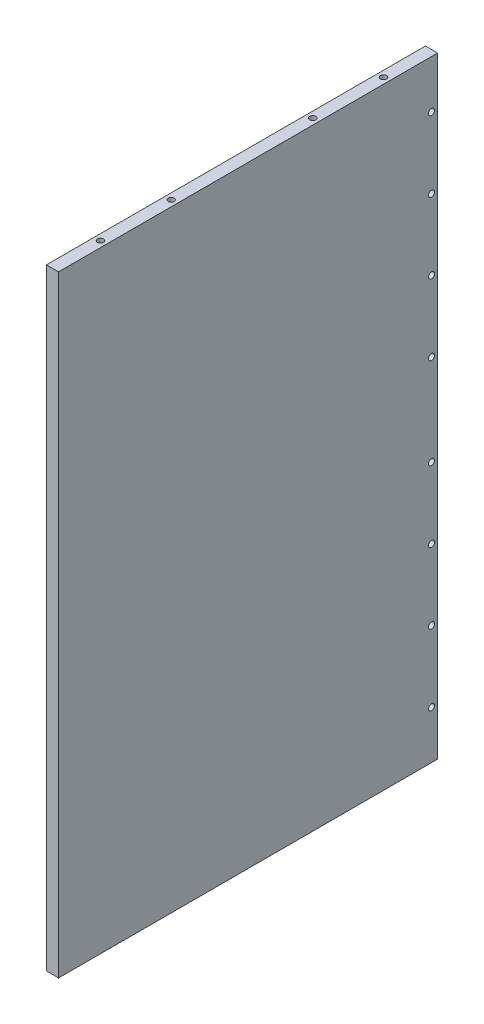
from build123d import *

# Parameters (mm, degrees)
CROQUIS2_W              = 375
CROQUIS2_H              = 605
SALIENTE_EXTRUIR1_DEPTH = 6
CROQUIS3_R              = 3
CORTAR_EXTRUIR1_DEPTH   = 12
CROQUIS6_R              = 3
CORTAR_EXTRUIR2_DEPTH   = 5


with BuildPart() as part:
    # Croquis2 → Saliente-Extruir1 (new, symmetric)
    with BuildSketch(Plane(origin=(0, 0, 0), x_dir=(0, 0, -1), z_dir=(1, 0, 0))):
        Rectangle(CROQUIS2_W, CROQUIS2_H)
    extrude(amount=SALIENTE_EXTRUIR1_DEPTH, both=True)

    # Croquis3 → Cortar-Extruir1 (cut)
    with BuildSketch(Plane(origin=(0, 302.5, 0), x_dir=(1, 0, 0), z_dir=(0, 1, 0))):
        with Locations(Location((0, 140, 0), (0, 0, 270))):
            Circle(CROQUIS3_R)
        with Locations(Location((0, 70, 0), (0, 0, 270))):
            Circle(CROQUIS3_R)
        with Locations(Location((0, -70, 0), (0, 0, 90))):
            Circle(CROQUIS3_R)
        with Locations(Location((0, -140, 0), (0, 0, 90))):
            Circle(CROQUIS3_R)
    cortar_extruir1 = extrude(amount=-CORTAR_EXTRUIR1_DEPTH, mode=Mode.SUBTRACT)

    # Simetría1: Cortar-Extruir1 across plane
    add(cortar_extruir1.mirror(Plane.ZX), mode=Mode.SUBTRACT)

    # Croquis6 → Cortar-Extruir2 (cut)
    with BuildSketch(Plane(origin=(6, 0, 0), x_dir=(0, 0, -1), z_dir=(1, 0, 0))):
        with Locations((181.5, -255)):
            Circle(CROQUIS6_R)
        with Locations((181.5, -185)):
            Circle(CROQUIS6_R)
        with Locations((181.5, -115)):
            Circle(CROQUIS6_R)
        with Locations((181.5, -45)):
            Circle(CROQUIS6_R)
        with Locations(Location((181.5, 45, 0), (0, 0, 180))):
            Circle(CROQUIS6_R)
        with Locations(Location((181.5, 115, 0), (0, 0, 180))):
            Circle(CROQUIS6_R)
        with Locations(Location((181.5, 185, 0), (0, 0, 180))):
            Circle(CROQUIS6_R)
        with Locations(Location((181.5, 255, 0), (0, 0, 180))):
            Circle(CROQUIS6_R)
    extrude(amount=-CORTAR_EXTRUIR2_DEPTH, mode=Mode.SUBTRACT)


solid = part.part
